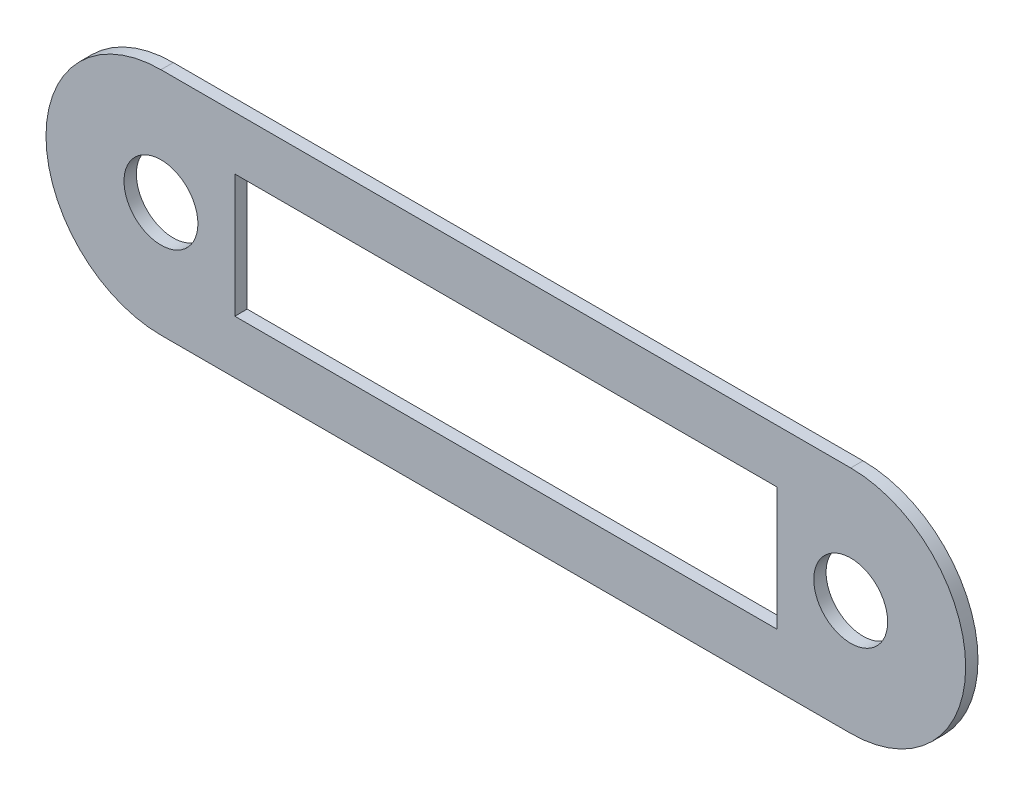
from build123d import *

# Parameters (mm, degrees)
BOSS_EXTRUDE1_DEPTH = 0.5
SKETCH2_R           = 1.5
CUT_EXTRUDE1_DEPTH  = 0.5
SKETCH3_R           = 1.5
CUT_EXTRUDE2_DEPTH  = 0.5
SKETCH4_W           = 22
SKETCH4_H           = 5
CUT_EXTRUDE3_DEPTH  = 0.5


with BuildPart() as part:
    # Sketch1 → Boss-Extrude1 (new body)
    with BuildSketch(Plane.XY):
        with BuildLine():
            Line((0, 4.666666667), (28, 4.666666667))
            ThreePointArc((28, 4.666666667), (32.666666667, 0), (28, -4.666666667))
            Line((28, -4.666666667), (0, -4.666666667))
            ThreePointArc((0, -4.666666667), (-4.666666667, 0), (0, 4.666666667))
        make_face()
    extrude(amount=BOSS_EXTRUDE1_DEPTH)

    # Sketch2 → Cut-Extrude1 (cut)
    with BuildSketch(Plane.XY.offset(0.5)):
        Circle(SKETCH2_R)
    extrude(amount=-CUT_EXTRUDE1_DEPTH, mode=Mode.SUBTRACT)

    # Sketch3 → Cut-Extrude2 (cut)
    with BuildSketch(Plane.XY.offset(0.5)):
        with Locations((28, 0)):
            Circle(SKETCH3_R)
    extrude(amount=-CUT_EXTRUDE2_DEPTH, mode=Mode.SUBTRACT)

    # Sketch4 → Cut-Extrude3 (cut)
    with BuildSketch(Plane.XY.offset(0.5)):
        with Locations((14, 0)):
            Rectangle(SKETCH4_W, SKETCH4_H)
    extrude(amount=-CUT_EXTRUDE3_DEPTH, mode=Mode.SUBTRACT)


solid = part.part
